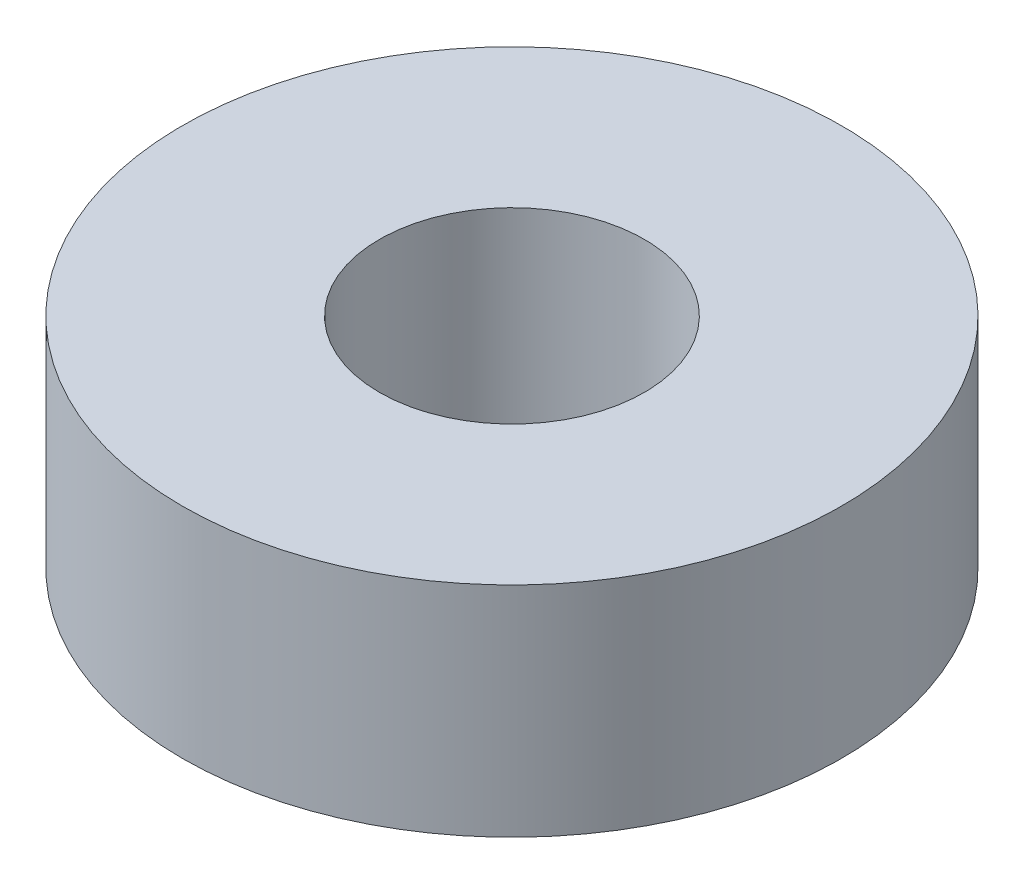
from build123d import *

# Parameters (mm, degrees)
SKETCH1_R               = 9.5
SKETCH1_R_2             = 3.45
BOSS_EXTRUDE1_DEPTH     = 3.05
CUT_EXTRUDE1_DEPTH      = 15.754999153
CUT_EXTRUDE1_DEPTH_BACK = 15.754999153
SKETCH2_R               = 9.5
SKETCH2_R_2             = 9.2
CUT_EXTRUDE2_DEPTH      = 15.369759914
CUT_EXTRUDE2_DEPTH_BACK = 15.369759914
SKETCH3_R               = 3.7


with BuildPart() as part:
    # Sketch1 → Boss-Extrude1 (new, symmetric)
    with BuildSketch(Plane(origin=(0, 0, 0), x_dir=(1, 0, 0), z_dir=(0, 1, 0))):
        with Locations(Location((0, 0, 0), (0, 0, 270))):
            Circle(SKETCH1_R)
        with Locations(Location((0, 0, 0), (0, 0, 270))):
            Circle(SKETCH1_R_2, mode=Mode.SUBTRACT)
    extrude(amount=BOSS_EXTRUDE1_DEPTH, both=True)

    # Sketch2 → Cut-Extrude1 (cut, two sides: drawn at the far end of the back side and taken through both)
    with BuildSketch(Plane(origin=(0, 3.05, 0), x_dir=(1, 0, 0), z_dir=(0, 1, 0)).offset(-CUT_EXTRUDE1_DEPTH_BACK)):
        Circle(SKETCH2_R)
        with Locations(Location((0, 0, 0), (0, 0, 270))):
            Circle(SKETCH2_R_2, mode=Mode.SUBTRACT)
    extrude(amount=CUT_EXTRUDE1_DEPTH + CUT_EXTRUDE1_DEPTH_BACK, mode=Mode.SUBTRACT)

    # Sketch3 → Cut-Extrude2 (cut, two sides: drawn at the far end of the back side and taken through both)
    with BuildSketch(Plane(origin=(0, 3.05, 0), x_dir=(1, 0, 0), z_dir=(0, 1, 0)).offset(-CUT_EXTRUDE2_DEPTH_BACK)):
        with Locations(Location((0, 0, 0), (0, 0, 270))):
            Circle(SKETCH3_R)
    extrude(amount=CUT_EXTRUDE2_DEPTH + CUT_EXTRUDE2_DEPTH_BACK, mode=Mode.SUBTRACT)


solid = part.part
